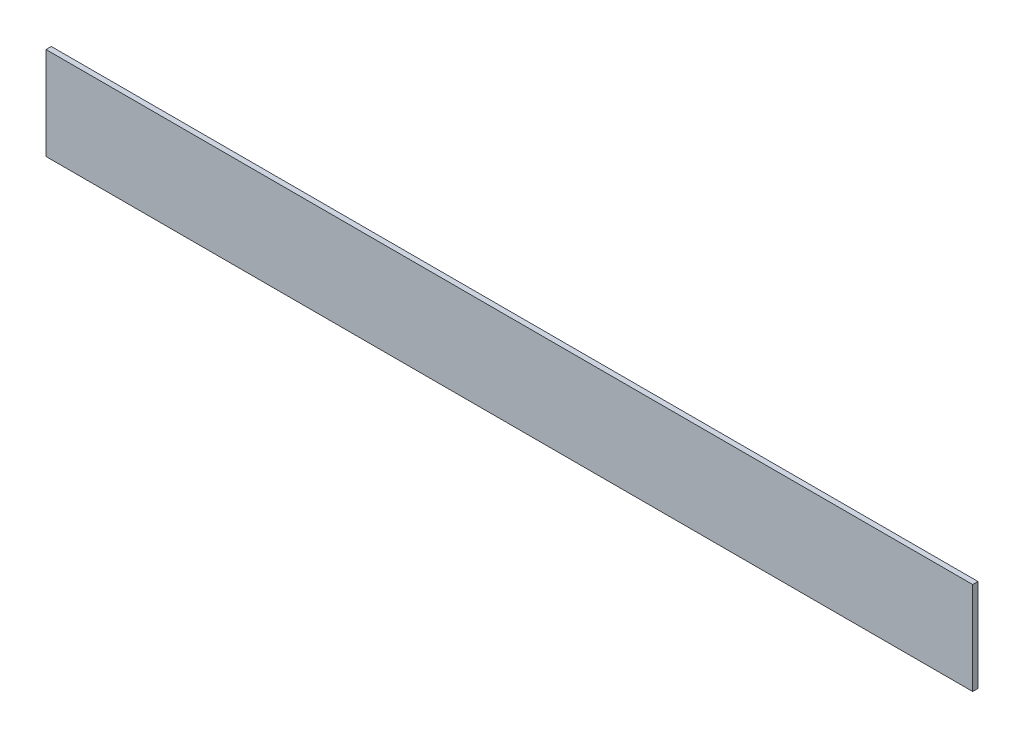
from build123d import *

# Parameters (mm, degrees)
SKETCH1_W           = 350
SKETCH1_H           = 2
BOSS_EXTRUDE1_DEPTH = 35


with BuildPart() as part:
    # Sketch1 → Boss-Extrude1 (new body)
    with BuildSketch(Plane(origin=(0, 0, 0), x_dir=(1, 0, 0), z_dir=(0, 1, 0))):
        with Locations((-36.275414463, 24)):
            Rectangle(SKETCH1_W, SKETCH1_H)
    extrude(amount=BOSS_EXTRUDE1_DEPTH)


solid = part.part
